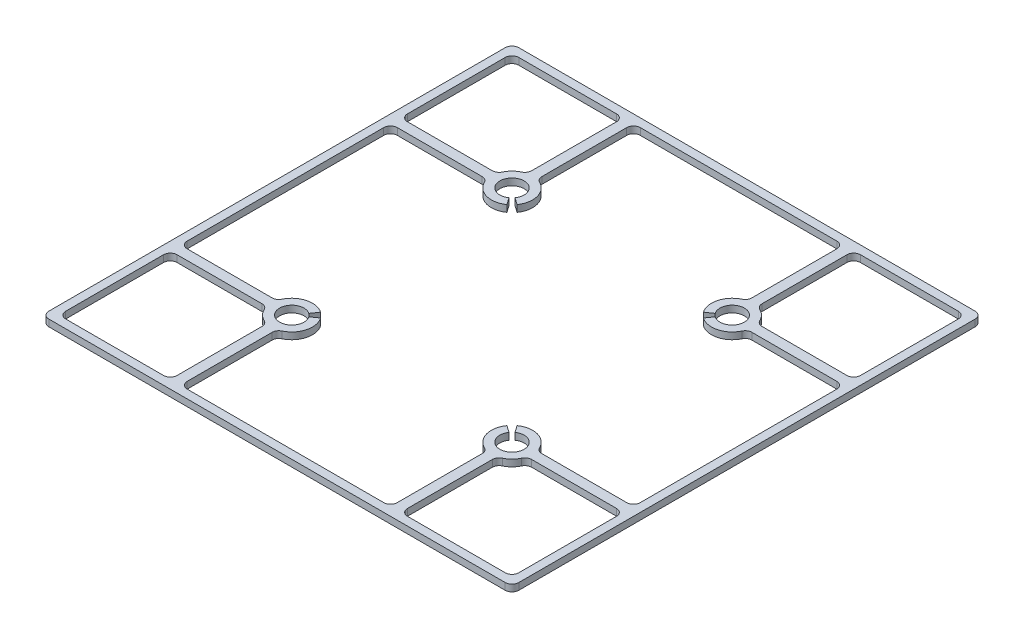
from build123d import *

# Parameters (mm, degrees)
BOSS_EXTRUDE2_DEPTH = 2


with BuildPart() as part:
    # Sketch1 → Boss-Extrude2 (new body)
    with BuildSketch(Plane(origin=(0, 0, 0), x_dir=(1, 0, 0), z_dir=(0, 1, 0))):
        with BuildLine():
            Line((69.363368179, -67.363368179), (69.363368179, 67.363368179))
            ThreePointArc((69.363368179, 67.363368179), (68.777581741, 68.777581741), (67.363368179, 69.363368179))
            Line((67.363368179, 69.363368179), (-67.363368179, 69.363368179))
            ThreePointArc((-67.363368179, 69.363368179), (-68.777581741, 68.777581741), (-69.363368179, 67.363368179))
            Line((-69.363368179, 67.363368179), (-69.363368179, -67.363368179))
            ThreePointArc((-69.363368179, -67.363368179), (-68.777581741, -68.777581741), (-67.363368179, -69.363368179))
            Line((-67.363368179, -69.363368179), (67.363368179, -69.363368179))
            ThreePointArc((67.363368179, -69.363368179), (68.777581741, -68.777581741), (69.363368179, -67.363368179))
        make_face()
        with BuildLine():
            Line((66.863368179, -64.863368179), (66.863368179, -35.99568434))
            ThreePointArc((66.863368179, -35.99568434), (66.277581741, -34.581470778), (64.863368179, -33.99568434))
            Line((64.863368179, -33.99568434), (39.806859174, -33.99568434))
            ThreePointArc((39.806859174, -33.99568434), (38.740619021, -34.303605165), (38.002696415, -35.132552404))
            ThreePointArc((38.002696415, -35.132552404), (36.814625157, -36.812077197), (35.135802469, -38.001140368))
            ThreePointArc((35.135802469, -38.001140368), (34.307605976, -38.739052609), (34, -39.804792947))
            Line((34, -39.804792947), (34, -64.863368179))
            ThreePointArc((34, -64.863368179), (34.585786438, -66.277581741), (36, -66.863368179))
            Line((36, -66.863368179), (64.863368179, -66.863368179))
            ThreePointArc((64.863368179, -66.863368179), (66.277581741, -66.277581741), (66.863368179, -64.863368179))
        make_face(mode=Mode.SUBTRACT)
        with BuildLine():
            Line((-64.863368179, 66.863368179), (-36, 66.863368179))
            ThreePointArc((-36, 66.863368179), (-34.585786438, 66.277581741), (-34, 64.863368179))
            Line((-34, 64.863368179), (-34, 39.804792947))
            ThreePointArc((-34, 39.804792947), (-34.307605976, 38.739052609), (-35.135802469, 38.001140368))
            ThreePointArc((-35.135802469, 38.001140368), (-36.814625157, 36.812077197), (-38.002696415, 35.132552404))
            ThreePointArc((-38.002696415, 35.132552404), (-38.740619021, 34.303605165), (-39.806859174, 33.99568434))
            Line((-39.806859174, 33.99568434), (-64.863368179, 33.99568434))
            ThreePointArc((-64.863368179, 33.99568434), (-66.277581741, 34.581470778), (-66.863368179, 35.99568434))
            Line((-66.863368179, 35.99568434), (-66.863368179, 64.863368179))
            ThreePointArc((-66.863368179, 64.863368179), (-66.277581741, 66.277581741), (-64.863368179, 66.863368179))
        make_face(mode=Mode.SUBTRACT)
        with BuildLine():
            Line((-66.863368179, -64.863368179), (-66.863368179, -35.99568434))
            ThreePointArc((-66.863368179, -35.99568434), (-66.277581741, -34.581470778), (-64.863368179, -33.99568434))
            Line((-64.863368179, -33.99568434), (-39.806859174, -33.99568434))
            ThreePointArc((-39.806859174, -33.99568434), (-38.740619021, -34.303605165), (-38.002696415, -35.132552404))
            ThreePointArc((-38.002696415, -35.132552404), (-36.814625157, -36.812077197), (-35.135802469, -38.001140368))
            ThreePointArc((-35.135802469, -38.001140368), (-34.307605976, -38.739052609), (-34, -39.804792947))
            Line((-34, -39.804792947), (-34, -64.863368179))
            ThreePointArc((-34, -64.863368179), (-34.585786438, -66.277581741), (-36, -66.863368179))
            Line((-36, -66.863368179), (-64.863368179, -66.863368179))
            ThreePointArc((-64.863368179, -66.863368179), (-66.277581741, -66.277581741), (-66.863368179, -64.863368179))
        make_face(mode=Mode.SUBTRACT)
        with BuildLine():
            Line((36, 66.863368179), (64.863368179, 66.863368179))
            ThreePointArc((64.863368179, 66.863368179), (66.277581741, 66.277581741), (66.863368179, 64.863368179))
            Line((66.863368179, 64.863368179), (66.863368179, 35.99568434))
            ThreePointArc((66.863368179, 35.99568434), (66.277581741, 34.581470778), (64.863368179, 33.99568434))
            Line((64.863368179, 33.99568434), (39.806859174, 33.99568434))
            ThreePointArc((39.806859174, 33.99568434), (38.740619021, 34.303605165), (38.002696415, 35.132552404))
            ThreePointArc((38.002696415, 35.132552404), (36.814625157, 36.812077197), (35.135802469, 38.001140368))
            ThreePointArc((35.135802469, 38.001140368), (34.307605976, 38.739052609), (34, 39.804792947))
            Line((34, 39.804792947), (34, 64.863368179))
            ThreePointArc((34, 64.863368179), (34.585786438, 66.277581741), (36, 66.863368179))
        make_face(mode=Mode.SUBTRACT)
        with BuildLine():
            Line((-30.435124829, 29.551052641), (-29.001183738, 27.50317253))
            ThreePointArc((-29.001183738, 27.50317253), (-34.049623523, 26.600112973), (-38.002696415, 29.867447596))
            ThreePointArc((-38.002696415, 29.867447596), (-38.740619021, 30.696394835), (-39.806859174, 31.00431566))
            Line((-39.806859174, 31.00431566), (-64.863368179, 31.00431566))
            ThreePointArc((-64.863368179, 31.00431566), (-66.277581741, 30.418529222), (-66.863368179, 29.00431566))
            Line((-66.863368179, 29.00431566), (-66.863368179, -29.00431566))
            ThreePointArc((-66.863368179, -29.00431566), (-66.277581741, -30.418529222), (-64.863368179, -31.00431566))
            Line((-64.863368179, -31.00431566), (-39.806859174, -31.00431566))
            ThreePointArc((-39.806859174, -31.00431566), (-38.740619021, -30.696394835), (-38.002696415, -29.867447596))
            ThreePointArc((-38.002696415, -29.867447596), (-34.049623523, -26.600112973), (-29.001183738, -27.50317253))
            Line((-29.001183738, -27.50317253), (-30.435124829, -29.551052641))
            ThreePointArc((-30.435124829, -29.551052641), (-35.045584412, -35.045584412), (-29.551052641, -30.435124829))
            Line((-29.551052641, -30.435124829), (-27.50317253, -29.001183738))
            ThreePointArc((-27.50317253, -29.001183738), (-26.599655537, -34.04788088), (-29.864197531, -38.001140368))
            ThreePointArc((-29.864197531, -38.001140368), (-30.692394024, -38.739052609), (-31, -39.804792947))
            Line((-31, -39.804792947), (-31, -64.863368179))
            ThreePointArc((-31, -64.863368179), (-30.414213562, -66.277581741), (-29, -66.863368179))
            Line((-29, -66.863368179), (29, -66.863368179))
            ThreePointArc((29, -66.863368179), (30.414213562, -66.277581741), (31, -64.863368179))
            Line((31, -64.863368179), (31, -39.804792947))
            ThreePointArc((31, -39.804792947), (30.692394024, -38.739052609), (29.864197531, -38.001140368))
            ThreePointArc((29.864197531, -38.001140368), (26.599655537, -34.04788088), (27.50317253, -29.001183738))
            Line((27.50317253, -29.001183738), (29.551052641, -30.435124829))
            ThreePointArc((29.551052641, -30.435124829), (35.045584412, -35.045584412), (30.435124829, -29.551052641))
            Line((30.435124829, -29.551052641), (29.001183738, -27.50317253))
            ThreePointArc((29.001183738, -27.50317253), (34.049623523, -26.600112973), (38.002696415, -29.867447596))
            ThreePointArc((38.002696415, -29.867447596), (38.740619021, -30.696394835), (39.806859174, -31.00431566))
            Line((39.806859174, -31.00431566), (64.863368179, -31.00431566))
            ThreePointArc((64.863368179, -31.00431566), (66.277581741, -30.418529222), (66.863368179, -29.00431566))
            Line((66.863368179, -29.00431566), (66.863368179, 29.00431566))
            ThreePointArc((66.863368179, 29.00431566), (66.277581741, 30.418529222), (64.863368179, 31.00431566))
            Line((64.863368179, 31.00431566), (39.806859174, 31.00431566))
            ThreePointArc((39.806859174, 31.00431566), (38.740619021, 30.696394835), (38.002696415, 29.867447596))
            ThreePointArc((38.002696415, 29.867447596), (34.049623523, 26.600112973), (29.001183738, 27.50317253))
            Line((29.001183738, 27.50317253), (30.435124829, 29.551052641))
            ThreePointArc((30.435124829, 29.551052641), (35.045584412, 35.045584412), (29.551052641, 30.435124829))
            Line((29.551052641, 30.435124829), (27.50317253, 29.001183738))
            ThreePointArc((27.50317253, 29.001183738), (26.599655537, 34.04788088), (29.864197531, 38.001140368))
            ThreePointArc((29.864197531, 38.001140368), (30.692394024, 38.739052609), (31, 39.804792947))
            Line((31, 39.804792947), (31, 64.863368179))
            ThreePointArc((31, 64.863368179), (30.414213562, 66.277581741), (29, 66.863368179))
            Line((29, 66.863368179), (-29, 66.863368179))
            ThreePointArc((-29, 66.863368179), (-30.414213562, 66.277581741), (-31, 64.863368179))
            Line((-31, 64.863368179), (-31, 39.804792947))
            ThreePointArc((-31, 39.804792947), (-30.692394024, 38.739052609), (-29.864197531, 38.001140368))
            ThreePointArc((-29.864197531, 38.001140368), (-26.599655537, 34.04788088), (-27.50317253, 29.001183738))
            Line((-27.50317253, 29.001183738), (-29.551052641, 30.435124829))
            ThreePointArc((-29.551052641, 30.435124829), (-35.045584412, 35.045584412), (-30.435124829, 29.551052641))
        make_face(mode=Mode.SUBTRACT)
    extrude(amount=BOSS_EXTRUDE2_DEPTH)


solid = part.part
